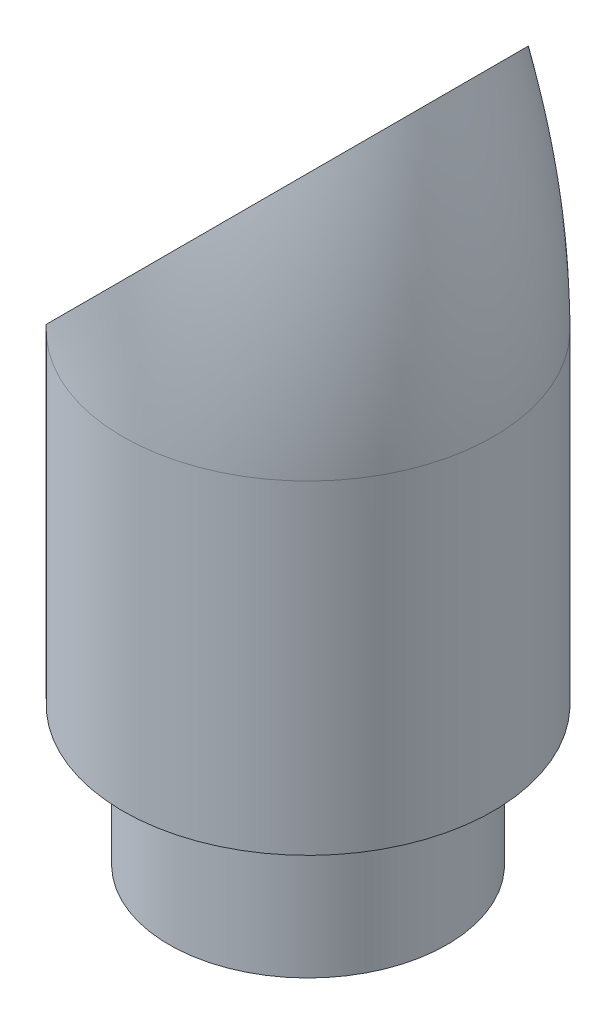
from build123d import *

# Parameters (mm, degrees)
SKETCH1_R               = 4
CUT_EXTRUDE1_START      = -3
SKETCH3_R               = 4
SKETCH3_R_2             = 3
CUT_EXTRUDE1_DEPTH      = 3
SKETCH4_R               = 4
SKETCH4_R_2             = 3
CUT_EXTRUDE2_DEPTH      = 3
SKETCH5_R               = 1.6
CUT_EXTRUDE3_DEPTH      = 10
SKETCH6_R               = 1.6
CUT_EXTRUDE4_DEPTH      = 10
CUT_EXTRUDE5_DEPTH      = 32.496031585
CUT_EXTRUDE5_DEPTH_BACK = 32.496031585
SKETCH14_R              = 1.5
BOSS_EXTRUDE4_DEPTH     = 10
SKETCH15_W              = 82.307095059
SKETCH15_H              = 58.72366942
CUT_EXTRUDE6_DEPTH      = 23.510122874


with BuildPart() as part:
    # Sweep1: sweep along a path in Sketch2
    with BuildLine(Plane.XY) as sweep1_path:
        Line((0, 0), (0, 10))
        ThreePointArc((0, 10), (-2.928932188, 17.071067812), (-10, 20))
        Line((-10, 20), (-20, 20))
    # Sketch1 → Sweep1 (sweep)
    with BuildSketch(Plane(origin=(0, 0, 0), x_dir=(1, 0, 0), z_dir=(0, 1, 0))):
        Circle(SKETCH1_R)
    sweep(path=sweep1_path.line)

    # Sketch3 → Cut-Extrude1 (cut)
    with BuildSketch(Plane.XZ.offset(CUT_EXTRUDE1_START)):
        Circle(SKETCH3_R)
        Circle(SKETCH3_R_2, mode=Mode.SUBTRACT)
    extrude(amount=CUT_EXTRUDE1_DEPTH, mode=Mode.SUBTRACT)

    # Sketch4 → Cut-Extrude2 (cut)
    with BuildSketch(Plane.ZY.offset(20)):
        with Locations((0, 20)):
            Circle(SKETCH4_R)
        with Locations((0, 20)):
            Circle(SKETCH4_R_2, mode=Mode.SUBTRACT)
    extrude(amount=-CUT_EXTRUDE2_DEPTH, mode=Mode.SUBTRACT)

    # Sketch5 → Cut-Extrude3 (cut)
    with BuildSketch(Plane.XZ):
        Circle(SKETCH5_R)
    extrude(amount=-CUT_EXTRUDE3_DEPTH, mode=Mode.SUBTRACT)

    # Sketch6 → Cut-Extrude4 (cut)
    with BuildSketch(Plane.ZY.offset(20)):
        with Locations((0, 20)):
            Circle(SKETCH6_R)
    extrude(amount=-CUT_EXTRUDE4_DEPTH, mode=Mode.SUBTRACT)

    # Sketch11 → Cut-Extrude5 (cut, two sides: drawn at the far end of the back side and taken through both)
    with BuildSketch(Plane.XY.offset(-CUT_EXTRUDE5_DEPTH_BACK)):
        Polygon((-15.076530842, 11.99453697), (5.142966103, 32.214033915), (12.214033915, 25.142966103), (-8.00546303, 4.923469158), align=None)
    extrude(amount=CUT_EXTRUDE5_DEPTH + CUT_EXTRUDE5_DEPTH_BACK, mode=Mode.SUBTRACT)


with BuildPart() as cut_extrude5_piece_1:
    # of the separate pieces the step leaves, piece 1, a body of its own (cut_extrude5_pieces)
    add(part.part.solids().sort_by_distance((4, 3, 0))[0])



with BuildPart() as cut_extrude5_piece_2:
    # of the separate pieces the step leaves, piece 2, a body of its own (cut_extrude5_pieces)
    add(part.part.solids().sort_by_distance((-10, 17.071067812, -2.724216628))[0])


with BuildPart() as cut_extrude5_piece_1_1:
    add(cut_extrude5_piece_1.part)

    add(cut_extrude5_piece_2.part)  # Boss-Extrude4 merges Cut-Extrude5 piece 2
    # Sketch14 → Boss-Extrude4 (add)
    with BuildSketch(Plane(origin=(-6.464466094, 6.464466094, 0), x_dir=(0, 0, 1), z_dir=(-0.7071067811865517, 0.7071067811865434, 0))):
        with Locations((0, 9.142135624)):
            Circle(SKETCH14_R)
    extrude(amount=BOSS_EXTRUDE4_DEPTH)

    # Sketch15 → Cut-Extrude6 (cut, through all)
    with BuildSketch(Plane(origin=(-6.464466094, 6.464466094, 0), x_dir=(0, 0, 1), z_dir=(-0.7071067811865517, 0.7071067811865434, 0))):
        with Locations((3.361016584, 6.067930336)):
            Rectangle(SKETCH15_W, SKETCH15_H)
    extrude(amount=CUT_EXTRUDE6_DEPTH, mode=Mode.SUBTRACT)


solid = cut_extrude5_piece_1_1.part
